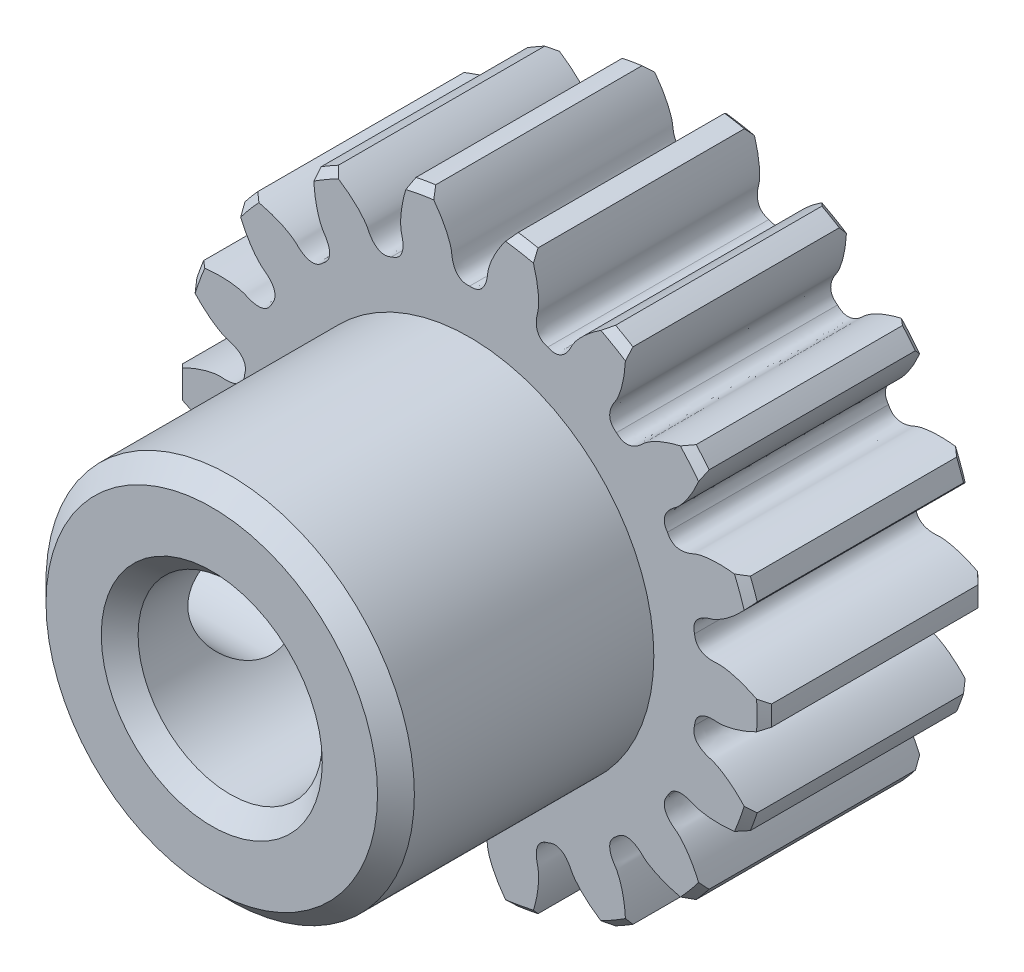
from build123d import *

# Parameters (mm, degrees)
GEAR_BASESKETCH_R                            = 8
F_0_8_MODULE_14_4000MM_P_D_DEPTH             = 3
TOOTH_CUT_COARSE_PITCH_INVOLUTE_20_DEG_DEPTH = 12.704699911
CHAMFER_693_SIZE                             = 0.2
TOOTH_PATTERN_18_18_COUNT                    = 18
SKETCH3_R                                    = 5
SKETCH3_R_2                                  = 2.5
EXTRUDE_1081_DEPTH                           = 7
SKETCH4_R                                    = 5
CUT_EXTRUDE_1352_DEPTH                       = 3
CUT_EXTRUDE_START                            = -3
SKETCH5_R                                    = 2.5
CUT_EXTRUDE_1595_DEPTH                       = 3
CHAMFER_1982_SIZE                            = 0.5
SKETCH6_R                                    = 1.65
CUT_EXTRUDE_2169_DEPTH                       = 4


with BuildPart() as part:
    # Gear-BaseSketch → 0.8 Module, 14,4000mm P.D. (new, symmetric)
    with BuildSketch(Plane.XY):
        Circle(GEAR_BASESKETCH_R)
    extrude(amount=F_0_8_MODULE_14_4000MM_P_D_DEPTH, both=True)

    # Tooth-Sketch; Backlash: 0,0000mm → Tooth-Cut, Coarse Pitch Involute 20 deg (cut, symmetric)
    with BuildSketch(Plane.XY):
        with BuildLine():
            ThreePointArc((-1.188717893, 8.000402693), (0, 8.08823179), (1.188717893, 8.000402693))
            add(Edge.make_bspline(
                [(1.188717893, 8.000402693), (1.108648495, 7.910450075), (0.998051204, 7.775624837), (0.868218399, 7.593430674), (0.787430611, 7.468912514), (0.718690931, 7.352116281), (0.661158946, 7.243835289), (0.61394864, 7.144803658), (0.5761317, 7.055693938), (0.546743771, 6.977114679), (0.524780351, 6.909609135), (0.509223911, 6.853651433), (0.498984499, 6.809650608), (0.493066583, 6.777934881), (0.490211937, 6.7587825), (0.488695415, 6.743519506), (0.486805922, 6.719579905), (0.482887828, 6.68328409), (0.474494991, 6.626197091), (0.460215171, 6.558499473), (0.436128003, 6.481824546), (0.404160225, 6.41014801), (0.361738483, 6.3426302), (0.304204321, 6.279928162), (0.190373189, 6.202235676), (0.075511388, 6.193069225), (0, 6.199445465)],
                knots=[0, 0, 0, 0, 0.157961946, 0.228480673, 0.293357902, 0.352593633, 0.406187867, 0.454140604, 0.496451843, 0.533121585, 0.56414983, 0.589536579, 0.609281832, 0.623385592, 0.631847864, 0.634668687, 0.643502696, 0.663346333, 0.682538951, 0.719174427, 0.753969949, 0.787768004, 0.82185533, 0.858103523, 0.898741151, 1, 1, 1, 1], degree=3))
            add(Edge.make_bspline(
                [(-1.188717893, 8.000402693), (-1.108648495, 7.910450075), (-0.998051204, 7.775624837), (-0.868218399, 7.593430674), (-0.787430611, 7.468912514), (-0.718690931, 7.352116281), (-0.661158946, 7.243835289), (-0.61394864, 7.144803658), (-0.5761317, 7.055693938), (-0.546743771, 6.977114679), (-0.524780351, 6.909609135), (-0.509223911, 6.853651433), (-0.498984499, 6.809650608), (-0.493066583, 6.777934881), (-0.490211937, 6.7587825), (-0.488695415, 6.743519506), (-0.486805922, 6.719579905), (-0.482887828, 6.68328409), (-0.474494991, 6.626197091), (-0.460215171, 6.558499473), (-0.436128003, 6.481824546), (-0.404160225, 6.41014801), (-0.361738483, 6.3426302), (-0.304204321, 6.279928162), (-0.190373189, 6.202235676), (-0.075511388, 6.193069225), (0, 6.199445465)],
                knots=[0, 0, 0, 0, 0.157961946, 0.228480673, 0.293357902, 0.352593633, 0.406187867, 0.454140604, 0.496451843, 0.533121585, 0.56414983, 0.589536579, 0.609281832, 0.623385592, 0.631847864, 0.634668687, 0.643502696, 0.663346333, 0.682538951, 0.719174427, 0.753969949, 0.787768004, 0.82185533, 0.858103523, 0.898741151, 1, 1, 1, 1], degree=3))
        make_face()
    tooth_cut_coarse_pitch_involute_20_deg = extrude(amount=TOOTH_CUT_COARSE_PITCH_INVOLUTE_20_DEG_DEPTH, both=True, mode=Mode.SUBTRACT)

    # Chamfer 693
    chamfer_693_edges = [part.edges().sort_by_distance(p)[0] for p in [
        (0, -8, -3),
        (0, -8, 3),
    ]]
    chamfer(chamfer_693_edges, length=CHAMFER_693_SIZE)

    # Tooth Pattern, 18 / 18: Tooth-Cut, Coarse Pitch Involute 20 deg ×18 about axis
    tooth_pattern_18_18_axis = Axis((0, 0, -4.277017338), (0, 0, 1))
    for i in range(1, TOOTH_PATTERN_18_18_COUNT):
        add(tooth_cut_coarse_pitch_involute_20_deg.rotate(tooth_pattern_18_18_axis, i * 360 / TOOTH_PATTERN_18_18_COUNT), mode=Mode.SUBTRACT)

    # Sketch3 → Extrude 1081 (add)
    with BuildSketch(Plane.XY.offset(3)):
        Circle(SKETCH3_R)
        Circle(SKETCH3_R_2, mode=Mode.SUBTRACT)
    extrude(amount=EXTRUDE_1081_DEPTH)

    # Sketch4 → Cut-Extrude 1352 (cut)
    with BuildSketch(Plane(origin=(0, 0, -3), x_dir=(-1, 0, 0), z_dir=(0, 0, -1))):
        Circle(SKETCH4_R)
    extrude(amount=-CUT_EXTRUDE_1352_DEPTH, mode=Mode.SUBTRACT)

    # Sketch5 → Cut-Extrude 1595 (cut)
    with BuildSketch(Plane.XY.offset(3).offset(CUT_EXTRUDE_START)):
        Circle(SKETCH5_R)
    extrude(amount=CUT_EXTRUDE_1595_DEPTH, mode=Mode.SUBTRACT)

    # Chamfer 1982
    chamfer_1982_edges = [part.edges().sort_by_distance(p)[0] for p in [
        (-5, 0, 10),
        (-2.5, 0, 10),
        (5, 0, -3),
        (-2.5, 0, 0),
    ]]
    chamfer(chamfer_1982_edges, length=CHAMFER_1982_SIZE)

    # Sketch6 → Cut-Extrude 2169 (cut)
    with BuildSketch(Plane.ZY.offset(5)):
        with Locations((6.5, 0)):
            Circle(SKETCH6_R)
    extrude(amount=-CUT_EXTRUDE_2169_DEPTH, mode=Mode.SUBTRACT)


solid = part.part
